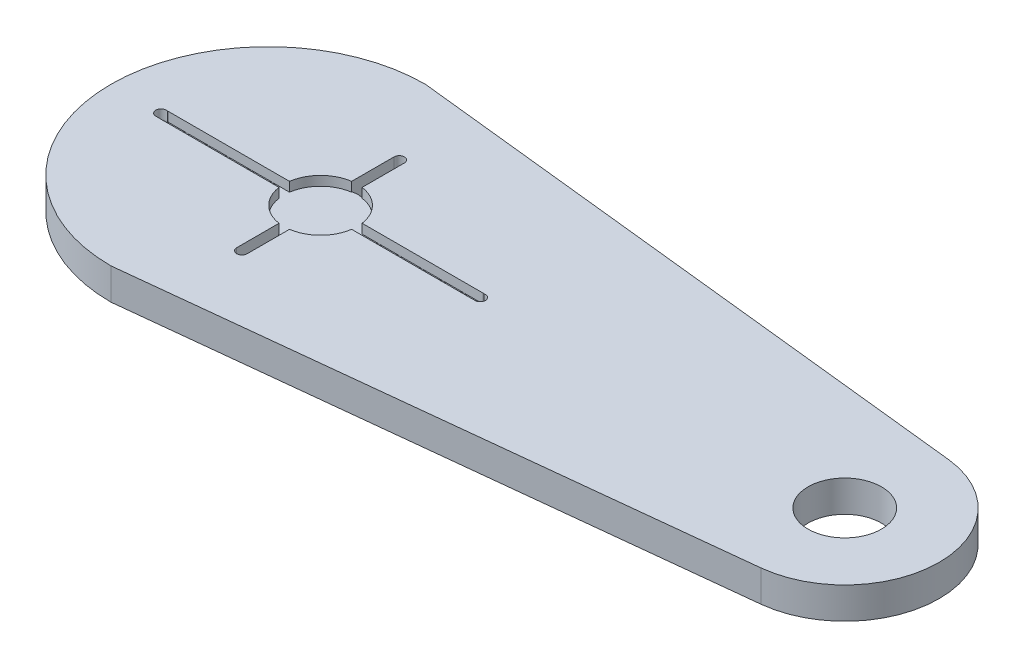
from build123d import *

# Parameters (mm, degrees)
BOSS_EXTRUDE1_DEPTH      = 2.1
FILLET1_R                = 2.13946
FILLET2_R                = 2.13946
SKETCH7_R                = 3.375
SKETCH7_R_2              = 2.425
BOSS_EXTRUDE4_DEPTH      = 0.5
SKETCH8_R                = 0.5
CUT_EXTRUDE4_DEPTH       = 19.04967105
SKETCH10_W               = 90
SKETCH10_H               = 30
SKETCH10_R               = 1.15
SKETCH10_R_2             = 0.5
SKETCH10_R_3             = 3
BOSS_EXTRUDE5_DEPTH      = 3
SKETCH11_R               = 3
BOSS_EXTRUDE6_DEPTH      = 20
SKETCH12_R               = 3.375
CUT_EXTRUDE10_DEPTH      = 20
FILLET4_RADIUS           = 15
FILLET4_LENGTH           = 3
CUT_EXTRUDE12_DEPTH      = 74.579888557
CUT_EXTRUDE13_DEPTH      = 64.206012372
SKETCH18_R               = 3.5
CUT_EXTRUDE14_DEPTH      = 10
BOSS_EXTRUDE7_DEPTH      = 10
BOSS_EXTRUDE7_DEPTH_BACK = 17
SKETCH19_R               = 3.5
CUT_EXTRUDE16_DEPTH      = 69.090013952
CUT_EXTRUDE16_DEPTH_BACK = 69.090013952
SKETCH21_R               = 3.5


with BuildPart() as part:
    # Sketch1 → Boss-Extrude1 (new body)
    with BuildSketch(Plane(origin=(0, 0, 0), x_dir=(1, 0, 0), z_dir=(0, 1, 0))):
        Polygon((-17.5, -1.95), (-17.5, 1.95), (0, 3.575), (17.5, 1.95), (17.5, -1.95), (0, -3.575), align=None)
    extrude(amount=BOSS_EXTRUDE1_DEPTH)

    # Fillet1
    fillet1_edges = [part.edges().sort_by_distance(p)[0] for p in [
        (17.5, 1.05, 1.95),
        (17.5, 1.05, -1.95),
    ]]
    fillet(fillet1_edges, radius=FILLET1_R)

    # Fillet2
    fillet2_edges = [part.edges().sort_by_distance(p)[0] for p in [
        (-17.5, 1.05, 1.95),
        (-17.5, 1.05, -1.95),
    ]]
    fillet(fillet2_edges, radius=FILLET2_R)

    # Sketch7 → Boss-Extrude4 (add)
    with BuildSketch(Plane.XZ):
        with Locations(Location((0, 0, 0), (0, 0, 270))):
            Circle(SKETCH7_R)
        with Locations(Location((0, 0, 0), (0, 0, 270))):
            Circle(SKETCH7_R_2, mode=Mode.SUBTRACT)
    extrude(amount=BOSS_EXTRUDE4_DEPTH)

    # Sketch8 → Cut-Extrude4 (cut, through all)
    with BuildSketch(Plane(origin=(0, 2.1, 0), x_dir=(1, 0, 0), z_dir=(0, 1, 0))):
        with Locations((0, -6.853859168)):
            Circle(SKETCH8_R)
        with Locations((0, -4.912931149)):
            Circle(SKETCH8_R)
        with Locations(Location((-5.078267216, 0, 0), (0, 0, 270))):
            Circle(SKETCH8_R)
        with Locations(Location((-7.071764575, 0, 0), (0, 0, 270))):
            Circle(SKETCH8_R)
        with Locations(Location((-9.266280326, 0, 0), (0, 0, 270))):
            Circle(SKETCH8_R)
        with Locations(Location((-11.188884616, 0, 0), (0, 0, 270))):
            Circle(SKETCH8_R)
        with Locations(Location((-13.233871693, 0, 0), (0, 0, 270))):
            Circle(SKETCH8_R)
        with Locations(Location((-15.221981798, 0, 0), (0, 0, 270))):
            Circle(SKETCH8_R)
        with Locations((0, 4.912931149)):
            Circle(SKETCH8_R)
        with Locations((0, 6.853859168)):
            Circle(SKETCH8_R)
        with Locations(Location((15.221981798, 0, 0), (0, 0, 90))):
            Circle(SKETCH8_R)
        with Locations(Location((13.233871693, 0, 0), (0, 0, 90))):
            Circle(SKETCH8_R)
        with Locations(Location((11.188884616, 0, 0), (0, 0, 90))):
            Circle(SKETCH8_R)
        with Locations(Location((9.266280326, 0, 0), (0, 0, 90))):
            Circle(SKETCH8_R)
        with Locations(Location((7.071764575, 0, 0), (0, 0, 90))):
            Circle(SKETCH8_R)
        with Locations(Location((5.078267216, 0, 0), (0, 0, 90))):
            Circle(SKETCH8_R)
    extrude(amount=-CUT_EXTRUDE4_DEPTH, mode=Mode.SUBTRACT)


with BuildPart() as body_2:
    # Sketch10 → Boss-Extrude5 (new body)
    with BuildSketch(Plane(origin=(0, 0, 0), x_dir=(1, 0, 0), z_dir=(0, 1, 0))):
        with Locations((25, 0)):
            Rectangle(SKETCH10_W, SKETCH10_H)
        with Locations(Location((0, 0, 0), (0, 0, 270))):
            Circle(SKETCH10_R, mode=Mode.SUBTRACT)
        with Locations(Location((-9.266280326, 0, 0), (0, 0, 270))):
            Circle(SKETCH10_R_2, mode=Mode.SUBTRACT)
        with Locations(Location((-7.071764575, 0, 0), (0, 0, 270))):
            Circle(SKETCH10_R_2, mode=Mode.SUBTRACT)
        with Locations(Location((-5.078267216, 0, 0), (0, 0, 270))):
            Circle(SKETCH10_R_2, mode=Mode.SUBTRACT)
        with Locations(Location((0, -4.912931149, 0), (0, 0, 270))):
            Circle(SKETCH10_R_2, mode=Mode.SUBTRACT)
        with Locations(Location((0, -6.853859168, 0), (0, 0, 270))):
            Circle(SKETCH10_R_2, mode=Mode.SUBTRACT)
        with Locations(Location((11.188884616, 0, 0), (0, 0, 270))):
            Circle(SKETCH10_R_2, mode=Mode.SUBTRACT)
        with Locations(Location((13.233871693, 0, 0), (0, 0, 270))):
            Circle(SKETCH10_R_2, mode=Mode.SUBTRACT)
        with Locations(Location((15.221981798, 0, 0), (0, 0, 270))):
            Circle(SKETCH10_R_2, mode=Mode.SUBTRACT)
        with Locations(Location((0, 6.853859168, 0), (0, 0, 270))):
            Circle(SKETCH10_R_2, mode=Mode.SUBTRACT)
        with Locations(Location((0, 4.912931149, 0), (0, 0, 270))):
            Circle(SKETCH10_R_2, mode=Mode.SUBTRACT)
        with Locations(Location((-15.221981798, 0, 0), (0, 0, 270))):
            Circle(SKETCH10_R_2, mode=Mode.SUBTRACT)
        with Locations(Location((-13.233871693, 0, 0), (0, 0, 270))):
            Circle(SKETCH10_R_2, mode=Mode.SUBTRACT)
        with Locations(Location((-11.188884616, 0, 0), (0, 0, 270))):
            Circle(SKETCH10_R_2, mode=Mode.SUBTRACT)
        with Locations(Location((5.078267216, 0, 0), (0, 0, 270))):
            Circle(SKETCH10_R_2, mode=Mode.SUBTRACT)
        with Locations(Location((7.071764575, 0, 0), (0, 0, 270))):
            Circle(SKETCH10_R_2, mode=Mode.SUBTRACT)
        with Locations(Location((9.266280326, 0, 0), (0, 0, 270))):
            Circle(SKETCH10_R_2, mode=Mode.SUBTRACT)
        with Locations(Location((50, 0, 0), (0, 0, 270))):
            Circle(SKETCH10_R_3, mode=Mode.SUBTRACT)
    extrude(amount=BOSS_EXTRUDE5_DEPTH)

    # Sketch11 → Boss-Extrude6 (add)
    with BuildSketch(Plane(origin=(0, 0, 0), x_dir=(1, 0, 0), z_dir=(0, 1, 0))):
        with Locations(Location((50, 0, 0), (0, 0, 270))):
            Circle(SKETCH11_R)
    extrude(amount=BOSS_EXTRUDE6_DEPTH)

    # Sketch12 → Cut-Extrude10 (cut)
    with BuildSketch(Plane(origin=(0, 3, 0), x_dir=(1, 0, 0), z_dir=(0, 1, 0))):
        with Locations(Location((0, 0, 0), (0, 0, 270))):
            Circle(SKETCH12_R)
    extrude(amount=-CUT_EXTRUDE10_DEPTH, mode=Mode.SUBTRACT)

    # Fillet4: full round fillet: the end face becomes a half cylinder, R = half its width
    fillet4_face = Plane((-20, 1.5, 0), x_dir=(0, -1, 0), z_dir=(-1, 0, 0))  # on the end face: x along it, z out of the body
    fillet4_slab = fillet4_face.offset(-FILLET4_RADIUS / 2) * Box(FILLET4_LENGTH, 2 * FILLET4_RADIUS, FILLET4_RADIUS, mode=Mode.PRIVATE)  # the body's end, R deep
    fillet4_round = Plane((-5, 1.5, 0), x_dir=(-1, 0, 0), z_dir=(0, -1, 0)) * Cylinder(FILLET4_RADIUS, FILLET4_LENGTH, mode=Mode.PRIVATE)  # its axis R under the face
    add(fillet4_slab - fillet4_round, mode=Mode.SUBTRACT)

    # Sketch16 → Cut-Extrude12 (cut, through all)
    with BuildSketch(Plane(origin=(0, 3, 0), x_dir=(1, 0, 0), z_dir=(0, 1, 0))):
        with BuildLine():
            Line((-5, 15), (50.967591597, 8.947835856))
            ThreePointArc((50.967591597, 8.947835856), (56.697325002, 6.012140868), (59, 0))
            ThreePointArc((59, 0), (56.697325002, -6.012140868), (50.967591597, -8.947835856))
            Line((50.967591597, -8.947835856), (-5, -15))
            Line((-5, -15), (70, -15))
            Line((70, -15), (70, 15))
            Line((70, 15), (-5, 15))
        make_face()
        Polygon((78.968120832, -25.258614279), (-5, -15), (70, -15), (70, 15), (-5, 15), (76.955100339, 20.369850225), align=None)
    extrude(amount=-CUT_EXTRUDE12_DEPTH, mode=Mode.SUBTRACT)

    # Sketch17 → Cut-Extrude13 (cut, through all)
    with BuildSketch(Plane(origin=(0, 3, 0), x_dir=(1, 0, 0), z_dir=(0, 1, 0))):
        with BuildLine():
            Line((-15, 0.5), (15, 0.5))
            ThreePointArc((15, 0.5), (15.5, 0), (15, -0.5))
            Line((15, -0.5), (-15, -0.5))
            ThreePointArc((-15, -0.5), (-15.5, 0), (-15, 0.5))
        make_face()
        with BuildLine():
            Line((-0.5, -7.5), (-0.5, 7.5))
            ThreePointArc((-0.5, 7.5), (0, 8), (0.5, 7.5))
            Line((0.5, 7.5), (0.5, -7.5))
            ThreePointArc((0.5, -7.5), (0, -8), (-0.5, -7.5))
        make_face()
    extrude(amount=-CUT_EXTRUDE13_DEPTH, mode=Mode.SUBTRACT)

    # Sketch18 → Cut-Extrude14 (cut)
    with BuildSketch(Plane(origin=(0, 3, 0), x_dir=(1, 0, 0), z_dir=(0, 1, 0))):
        Circle(SKETCH18_R)
    extrude(amount=-CUT_EXTRUDE14_DEPTH, mode=Mode.SUBTRACT)

    # Sketch19 → Boss-Extrude7 (add, two sides: drawn at the far end of the back side and taken through both)
    with BuildSketch(Plane(origin=(0, 20, 0), x_dir=(1, 0, 0), z_dir=(0, 1, 0)).offset(-BOSS_EXTRUDE7_DEPTH_BACK)):
        with Locations(Location((50, 0, 0), (0, 0, 270))):
            Circle(SKETCH19_R)
    extrude(amount=BOSS_EXTRUDE7_DEPTH + BOSS_EXTRUDE7_DEPTH_BACK)

    # Sketch21 → Cut-Extrude16 (cut, two sides: drawn at the far end of the back side and taken through both)
    with BuildSketch(Plane(origin=(0, 30, 0), x_dir=(1, 0, 0), z_dir=(0, 1, 0)).offset(-CUT_EXTRUDE16_DEPTH_BACK)):
        with Locations(Location((50, 0, 0), (0, 0, 270))):
            Circle(SKETCH21_R)
    extrude(amount=CUT_EXTRUDE16_DEPTH + CUT_EXTRUDE16_DEPTH_BACK, mode=Mode.SUBTRACT)


solid = Compound([part.part, body_2.part])
